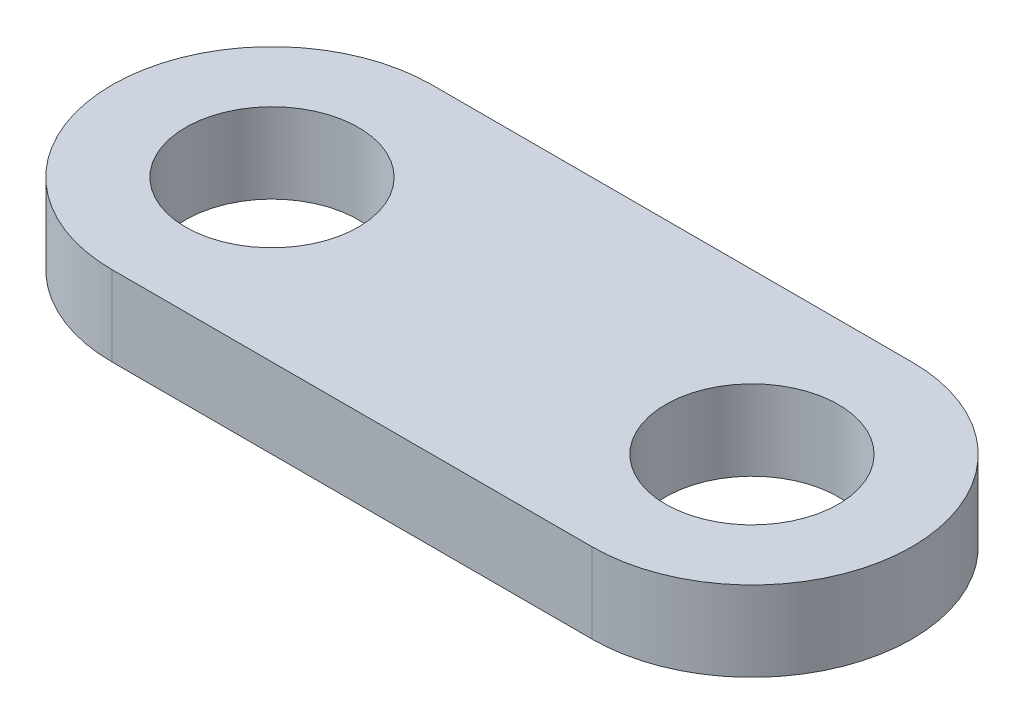
from build123d import *

# Parameters (mm, degrees)
SKETCH1_R           = 2.7
BOSS_EXTRUDE1_DEPTH = 2.5


with BuildPart() as part:
    # Sketch1 → Boss-Extrude1 (new body)
    with BuildSketch(Plane(origin=(0, 0, 0), x_dir=(1, 0, 0), z_dir=(0, 1, 0))):
        with BuildLine():
            Line((-7.5, 5), (7.5, 5))
            ThreePointArc((7.5, 5), (12.5, 0), (7.5, -5))
            Line((7.5, -5), (-7.5, -5))
            ThreePointArc((-7.5, -5), (-12.5, 0), (-7.5, 5))
        make_face()
        with Locations(Location((-7.5, 0, 0), (0, 0, 270))):
            Circle(SKETCH1_R, mode=Mode.SUBTRACT)
        with Locations(Location((7.5, 0, 0), (0, 0, 270))):
            Circle(SKETCH1_R, mode=Mode.SUBTRACT)
    extrude(amount=BOSS_EXTRUDE1_DEPTH)


solid = part.part
